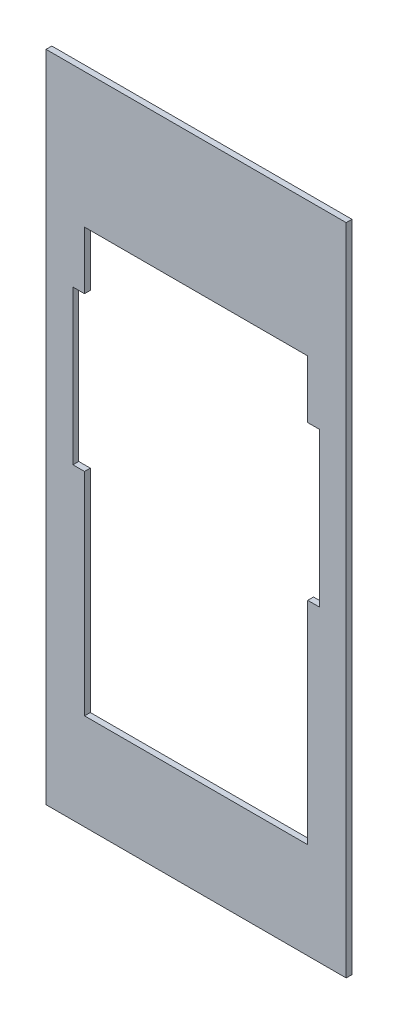
from build123d import *

# Parameters (mm, degrees)
SKETCH1_W           = 78
SKETCH1_H           = 170
BOSS_EXTRUDE1_DEPTH = 1.5


with BuildPart() as part:
    # Sketch1 → Boss-Extrude1 (new body)
    with BuildSketch(Plane.XY):
        Rectangle(SKETCH1_W, SKETCH1_H)
        Polygon((29, 50), (-29, 50), (-29, 35), (-32, 35), (-32, -5), (-29, -5), (-29, -60), (29, -60), (29, -5), (32, -5), (32, 35), (29, 35), align=None, mode=Mode.SUBTRACT)
    extrude(amount=BOSS_EXTRUDE1_DEPTH)


solid = part.part
